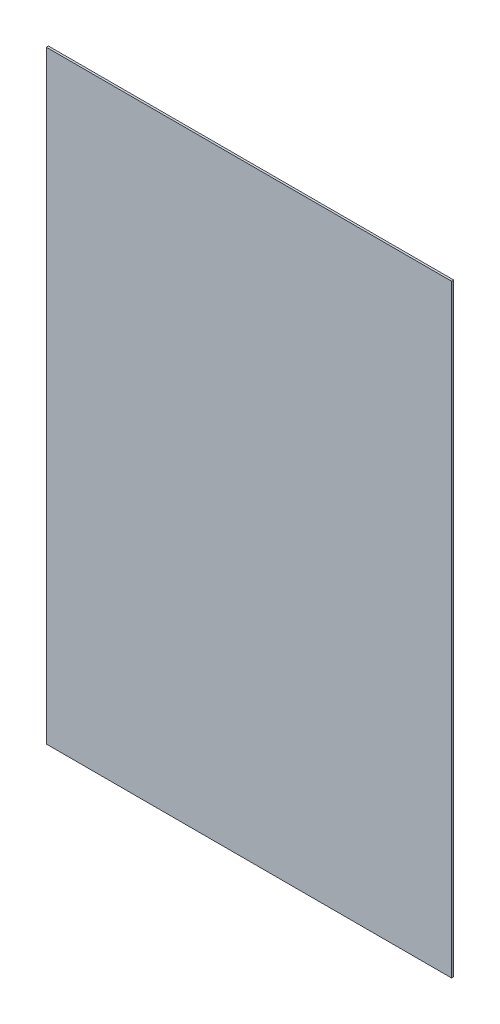
from build123d import *

# Parameters (mm, degrees)
SKETCH1_W           = 226.98
SKETCH1_H           = 338
BOSS_EXTRUDE1_DEPTH = 1.2


with BuildPart() as part:
    # Sketch1 → Boss-Extrude1 (new body)
    with BuildSketch(Plane.XY):
        with Locations((0, -159.5)):
            Rectangle(SKETCH1_W, SKETCH1_H)
    extrude(amount=BOSS_EXTRUDE1_DEPTH)


solid = part.part
